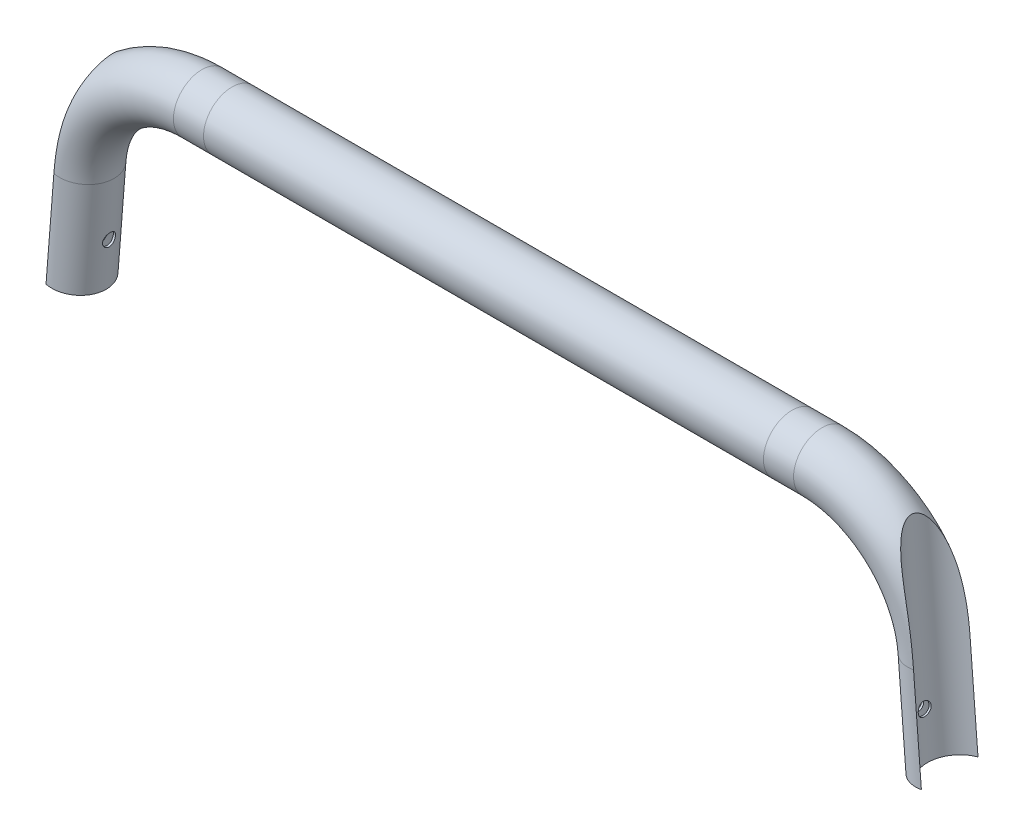
from build123d import *

# Parameters (mm, degrees)
SKETCH2_R               = 11
SKETCH2_R_2             = 10.2
SKETCH3_R               = 11.23581799789534
CUT_EXTRUDE1_DEPTH      = 213.9802077539031
BOSS_EXTRUDE1_REACH     = 206.639
CUT_EXTRUDE2_REACH      = 350.607
CUT_EXTRUDE2_END_RADIUS = 10.999999999999984
SKETCH8_R               = 2.4999999999999996


with BuildPart() as part:
    # Sweep1: sweep along a path in Sketch1
    with BuildLine(Plane.XY) as sweep1_path:
        Line((-167.5, -80), (-164.46757134740213, -41.46934069224712))
        ThreePointArc((-164.46757134740213, -41.46934069224712), (-150.15232487839378, -11.95548707539421), (-119.60629132941136, 0))
        Line((-119.60629132941136, 0), (-108, 0))
        Line((-108, 0), (108, 3.968e-14))
        Line((108, 3.968e-14), (119.60629132941136, 0))
        ThreePointArc((119.60629132941136, 0), (150.15232487839378, -11.955487075394203), (164.46757134740213, -41.46934069224713))
        Line((164.46757134740213, -41.46934069224713), (167.5, -80))
    # Sketch2 → Sweep1 (sweep)
    with BuildSketch(Plane(origin=(-167.49999999999997, -80, 0), x_dir=(-0.9969173337331282, 0.07845909572784168, 0), z_dir=(-0.07845909572784168, -0.9969173337331282, 0))):
        Circle(SKETCH2_R)
        Circle(SKETCH2_R_2, mode=Mode.SUBTRACT)
    sweep(path=sweep1_path.line)

    # Sketch3 → Cut-Extrude1 (cut, through all)
    with BuildSketch(Plane(origin=(7.288480076766105, -92.60892007092433, 0), x_dir=(0.9969173337331282, 0.07845909572784168, 0), z_dir=(0.07845909572784168, -0.9969173337331282, 0))):
        with Locations((164.70692574207166, 0)):
            Circle(SKETCH3_R)
    cut_extrude1 = extrude(amount=-CUT_EXTRUDE1_DEPTH, mode=Mode.SUBTRACT)

    # Mirror1: Cut-Extrude1 across plane
    add(cut_extrude1.mirror(Plane(origin=(0, 0, 0), x_dir=(0, 0, 1), z_dir=(1, 0, 0))), mode=Mode.SUBTRACT)

    # Sketch6 → Boss-Extrude1 (add, up to next)
    with BuildSketch(Plane(origin=(7.288480076766107, -92.60892007092434, 0), x_dir=(0.9969173337331283, 0.07845909572784171, 0), z_dir=(0.07845909572784171, -0.9969173337331283, 0)), mode=Mode.PRIVATE) as boss_extrude1_sk1:
        with BuildLine():
            ThreePointArc((162.0514749818429, 10.917517453241373), (153.4711077441763, 1.38e-15), (162.0514749818429, -10.917517453241373))
            ThreePointArc((162.0514749818429, -10.917517453241373), (160.88891450308557, -10.998494446553313), (159.72431138226378, -10.956024325452129))
            ThreePointArc((159.72431138226378, -10.956024325452129), (152.67110774417628, 1.47e-15), (159.72431138226378, 10.956024325452129))
            ThreePointArc((159.72431138226378, 10.956024325452129), (160.88891450308557, 10.99849444655331), (162.0514749818429, 10.917517453241373))
        make_face()
    boss_extrude1_tool1 = extrude(boss_extrude1_sk1.sketch, amount=-BOSS_EXTRUDE1_REACH, mode=Mode.PRIVATE) - part.part
    boss_extrude1 = boss_extrude1_tool1.solids().sort_by_distance((160.048061, -80.58648, 0))[0]
    add(boss_extrude1)

    # Mirror2: Boss-Extrude1 across plane
    add(boss_extrude1.mirror(Plane(origin=(0, 0, 0), x_dir=(0, 0, 1), z_dir=(1, 0, 0))))

    # Cut-Extrude2: up to this cylinder (the profile starts inside it)
    cut_extrude2_end = Plane(origin=(166.14248582919112, -62.75114701344296, 0), z_dir=(0.0784590957278417, -0.9969173337331283, 0)) * Cylinder(CUT_EXTRUDE2_END_RADIUS, 724.214, mode=Mode.PRIVATE)
    # Sketch8 → Cut-Extrude2 (cut, up to the surface)
    with BuildSketch(Plane(origin=(167.5, -80.00000000000001, 0), x_dir=(7.6e-16, 6e-17, -1), z_dir=(0.9969173337331283, 0.0784590957278417, 0)), mode=Mode.PRIVATE) as cut_extrude2_sk1:
        with Locations(Location((0, 17.30218999047264, 0), (0, 0, 90))):
            Circle(SKETCH8_R)
    cut_extrude2_tool1 = extrude(cut_extrude2_sk1.sketch, amount=-CUT_EXTRUDE2_REACH, mode=Mode.PRIVATE) & cut_extrude2_end
    cut_extrude2 = cut_extrude2_tool1.solids().sort_by_distance((166.142486, -62.751147, 0))[0]
    add(cut_extrude2, mode=Mode.SUBTRACT)

    # Mirror3: Cut-Extrude2 across plane
    add(cut_extrude2.mirror(Plane(origin=(0, 0, 0), x_dir=(0, 0, 1), z_dir=(1, 0, 0))), mode=Mode.SUBTRACT)


solid = part.part
